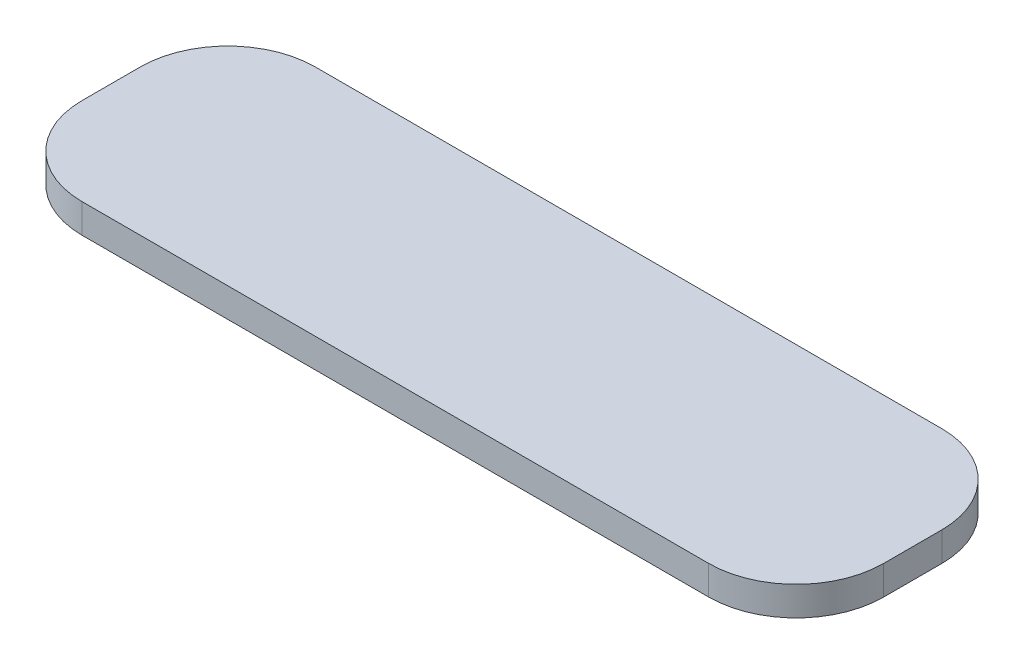
from build123d import *

# Parameters (mm, degrees)
EXTRUDE_1_DEPTH = 10


with BuildPart() as part:
    # Эскиз1 → Бобышка-Вытянуть1 (new body)
    with BuildSketch(Plane(origin=(0, 0, 0), x_dir=(1, 0, 0), z_dir=(0, 1, 0))):
        with BuildLine():
            Line((-33.890533661, -65.478802185), (181.109466339, -65.478802185))
            ThreePointArc((181.109466339, -65.478802185), (202.322669775, -56.692005621), (211.109466339, -35.478802185))
            Line((211.109466339, -35.478802185), (211.109466339, -15.458681769))
            ThreePointArc((211.109466339, -15.458681769), (202.322669775, 5.754521666), (181.109466339, 14.541318231))
            Line((181.109466339, 14.541318231), (-33.890533661, 14.541318231))
            ThreePointArc((-33.890533661, 14.541318231), (-55.103737097, 5.754521666), (-63.890533661, -15.458681769))
            Line((-63.890533661, -15.458681769), (-63.890533661, -35.478802185))
            ThreePointArc((-63.890533661, -35.478802185), (-55.103737097, -56.692005621), (-33.890533661, -65.478802185))
        make_face()
    extrude(amount=EXTRUDE_1_DEPTH)


solid = part.part
